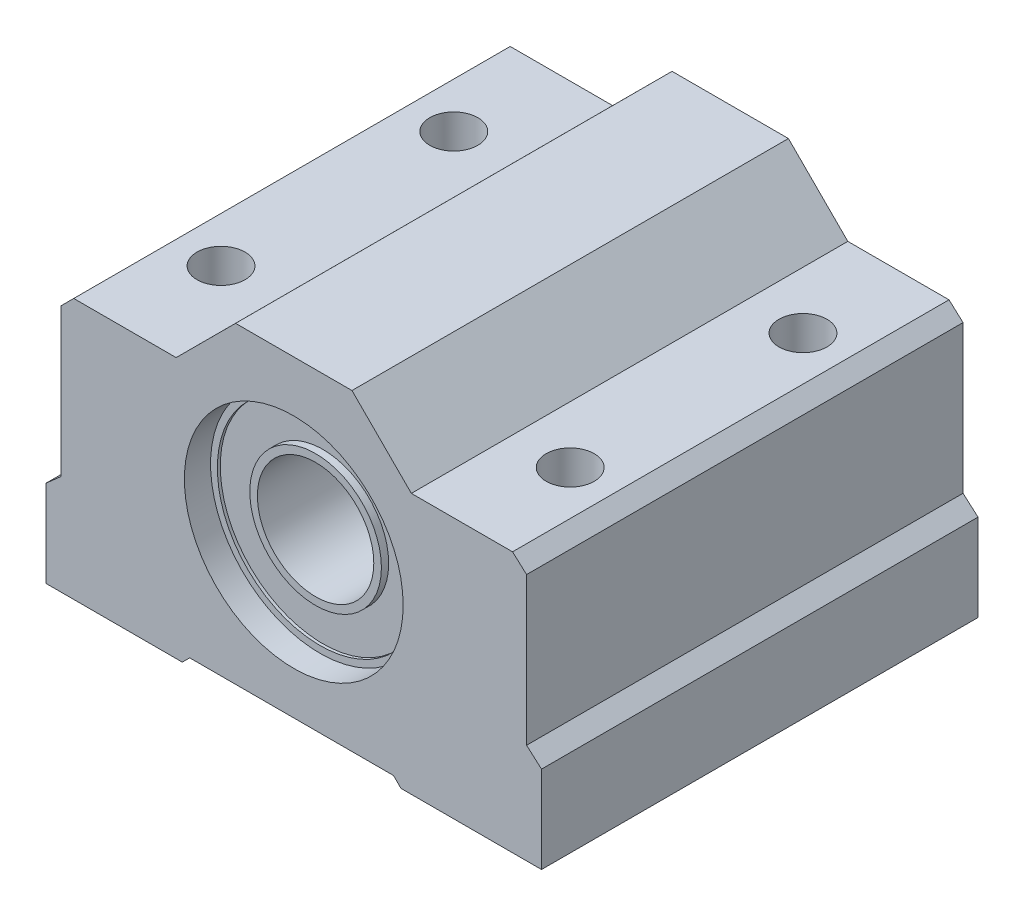
from build123d import *

# Parameters (mm, degrees)
ESQUISSE1_R             = 7.519017315
BOSS_EXTRU_1_DEPTH      = 30
ESQUISSE1_3_R           = 7.051788316
ESQUISSE1_3_R_2         = 4.523392982
BOSS_EXTRU_2_DEPTH      = 28
ESQUISSE1_4_R           = 7.519017315
ESQUISSE1_4_R_2         = 7.051788316
BOSS_EXTRU_3_DEPTH      = 30
ESQUISSE1_5_R           = 4.523392982
ESQUISSE1_5_R_2         = 4
BOSS_EXTRU_4_DEPTH      = 28.5
ESQUISSE1_6_R           = 4.523392982
ESQUISSE1_6_R_2         = 4
ENL_V_MAT_EXTRU_1_DEPTH = 1.5
ESQUISSE1_7_R           = 7.051788316
ESQUISSE1_7_R_2         = 4.523392982
ENL_V_MAT_EXTRU_2_DEPTH = 2
ESQUISSE1_8_R           = 7.519017315
ESQUISSE1_8_R_2         = 7.051788316
ENL_V_MAT_EXTRU_3_DEPTH = 1.8
ENL_V_START             = -28.2
ESQUISSE1_9_R           = 7.519017315
ESQUISSE1_9_R_2         = 7.051788316
ENL_V_MAT_EXTRU_4_DEPTH = 1.8
ESQUISSE2_R             = 1.65
ENL_V_MAT_EXTRU_5_DEPTH = 21.8


with BuildPart() as part:
    # Esquisse1 → Boss.-Extru.1 (new body)
    with BuildSketch(Plane.XY):
        Polygon((-15.997216081, -4.089203195), (-17.03, -5.004453984), (-17.03, -10.973805396), (-7.66267479, -10.973805396), (-7.153229177, -10.464359784), (6.857616233, -10.464359784), (7.367061846, -10.973805396), (17.03, -10.973805396), (17.03, -4.995255883), (16.002783919, -4.089203195), (16.002783919, 6.07141612), (15.037454618, 6.944265115), (8.081929489, 6.944265115), (4, 11.026194604), (-4, 11.026194604), (-8.083891517, 6.944265115), (-15.124367087, 6.944265115), (-15.997216081, 6.07141612), align=None)
        Circle(ESQUISSE1_R, mode=Mode.SUBTRACT)
    extrude(amount=-BOSS_EXTRU_1_DEPTH)



with BuildPart() as body_2:
    # Esquisse1<3> → Boss.-Extru.2 (new body)
    with BuildSketch(Plane.XY):
        Circle(ESQUISSE1_3_R)
        Circle(ESQUISSE1_3_R_2, mode=Mode.SUBTRACT)
    extrude(amount=-BOSS_EXTRU_2_DEPTH)


with BuildPart() as part_1:
    add(part.part)

    add(body_2.part)  # Boss.-Extru.3 merges body 2
    # Esquisse1<4> → Boss.-Extru.3 (add)
    with BuildSketch(Plane.XY):
        Circle(ESQUISSE1_4_R)
        Circle(ESQUISSE1_4_R_2, mode=Mode.SUBTRACT)
    extrude(amount=-BOSS_EXTRU_3_DEPTH)

    # Esquisse1<5> → Boss.-Extru.4 (add)
    with BuildSketch(Plane.XY):
        Circle(ESQUISSE1_5_R)
        Circle(ESQUISSE1_5_R_2, mode=Mode.SUBTRACT)
    extrude(amount=-BOSS_EXTRU_4_DEPTH)

    # Esquisse1<6> → Enlèv. mat.-Extru.1 (cut)
    with BuildSketch(Plane.XY):
        Circle(ESQUISSE1_6_R)
        Circle(ESQUISSE1_6_R_2, mode=Mode.SUBTRACT)
    extrude(amount=-ENL_V_MAT_EXTRU_1_DEPTH, mode=Mode.SUBTRACT)

    # Esquisse1<7> → Enlèv. mat.-Extru.2 (cut)
    with BuildSketch(Plane.XY):
        Circle(ESQUISSE1_7_R)
        Circle(ESQUISSE1_7_R_2, mode=Mode.SUBTRACT)
    extrude(amount=-ENL_V_MAT_EXTRU_2_DEPTH, mode=Mode.SUBTRACT)

    # Esquisse1<8> → Enlèv. mat.-Extru.3 (cut)
    with BuildSketch(Plane.XY):
        Circle(ESQUISSE1_8_R)
        Circle(ESQUISSE1_8_R_2, mode=Mode.SUBTRACT)
    extrude(amount=-ENL_V_MAT_EXTRU_3_DEPTH, mode=Mode.SUBTRACT)

    # Esquisse1<9> → Enlèv. mat.-Extru.4 (cut)
    with BuildSketch(Plane.XY.offset(ENL_V_START)):
        Circle(ESQUISSE1_9_R)
        Circle(ESQUISSE1_9_R_2, mode=Mode.SUBTRACT)
    extrude(amount=-ENL_V_MAT_EXTRU_4_DEPTH, mode=Mode.SUBTRACT)

    # Esquisse2 → Enlèv. mat.-Extru.5 (cut)
    with BuildSketch(Plane.XZ.offset(10.973805396)):
        with Locations((-12, -7)):
            Circle(ESQUISSE2_R)
        with Locations((12, -7)):
            Circle(ESQUISSE2_R)
        with Locations((12, -23)):
            Circle(ESQUISSE2_R)
        with Locations((-12, -23)):
            Circle(ESQUISSE2_R)
    extrude(amount=-ENL_V_MAT_EXTRU_5_DEPTH, mode=Mode.SUBTRACT)


solid = part_1.part
